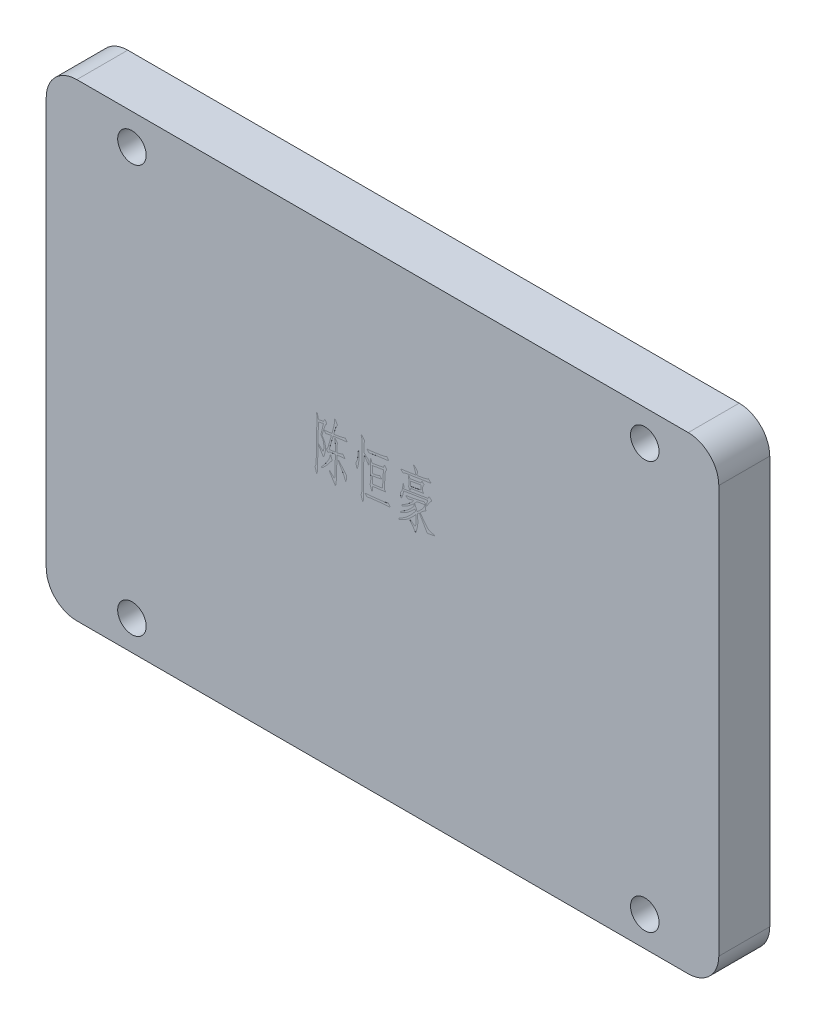
from build123d import *

# Parameters (mm, degrees)
EXTRUDE_1_DEPTH     = 25
SKETCH_4_R          = 7
CUT_EXTRUDE_5_DEPTH = 25
CUT_EXTRUDE_7_DEPTH = 0.001


with BuildPart() as part:
    # 草图2 → 凸台-拉伸1 (new body)
    with BuildSketch(Plane.XY):
        with BuildLine():
            Line((15, 0), (315, 0))
            ThreePointArc((315, 0), (325.606601718, 4.393398282), (330, 15))
            Line((330, 15), (330, 215))
            ThreePointArc((330, 215), (325.606601718, 225.606601718), (315, 230))
            Line((315, 230), (15, 230))
            ThreePointArc((15, 230), (4.393398282, 225.606601718), (0, 215))
            Line((0, 215), (0, 15))
            ThreePointArc((0, 15), (4.393398282, 4.393398282), (15, 0))
        make_face()
    extrude(amount=EXTRUDE_1_DEPTH)

    # 草图4 → 切除-拉伸5 (cut)
    with BuildSketch(Plane.XY.offset(25)):
        with Locations((293.684848485, 214.839097249)):
            Circle(SKETCH_4_R)
        with Locations((293.684848485, 14.669247649)):
            Circle(SKETCH_4_R)
        with Locations((42.049496033, 14.669247649)):
            Circle(SKETCH_4_R)
        with Locations((42.049496033, 214.839097249)):
            Circle(SKETCH_4_R)
    extrude(amount=-CUT_EXTRUDE_5_DEPTH, mode=Mode.SUBTRACT)

    # 草图5 → 切除-拉伸7 (cut)
    # profile 1 of 13: a face of its own
    with BuildSketch(Plane.XY.offset(25)):
        with BuildLine():
            Line((133.559721883, 144.852875731), (136.091151672, 145.287565695))
            Line((136.091151672, 145.287565695), (136.525841635, 146.26348728))
            add(Edge.make_bspline(
                [(136.525841635, 146.26348728), (136.546628512, 146.298616678), (136.582041878, 146.358464546), (136.672818537, 146.412428944), (136.773514904, 146.379627419), (136.816084523, 146.325348842), (136.841204942, 146.293318944)],
                knots=[0, 0, 0, 0, 1.183602122, 2.016432572, 2.829492834, 4, 4, 4, 4], degree=3))
            Line((136.841204942, 146.293318944), (137.501763221, 145.402630685))
            add(Edge.make_bspline(
                [(137.501763221, 145.402630685), (137.532043528, 145.344133642), (137.582521003, 145.246618678), (137.647387814, 145.097782708), (137.583417287, 144.935380522), (137.499688976, 144.851132498), (137.446361559, 144.797474069)],
                knots=[0, 0, 0, 0, 1.160113688, 1.93391731, 2.684090803, 4, 4, 4, 4], degree=3))
            add(Edge.make_bspline(
                [(137.446361559, 144.797474069), (137.378497811, 144.717777625), (137.256316562, 144.574292903), (137.097164581, 144.39386913), (136.990471305, 144.20558996), (136.896284388, 143.979644948), (136.773193892, 143.66402406), (136.652018312, 143.334454145), (136.539069923, 142.994640508), (136.422565798, 142.656538901), (136.291805902, 142.238932976), (136.135272575, 141.747062201), (135.948973884, 141.180709585), (135.75195783, 140.53526103), (135.523997283, 139.816140388), (135.367738364, 139.30997816), (135.285696739, 139.044224548)],
                knots=[0, 0, 0, 0, 0.711409262, 1.280814499, 1.626572014, 2.175004179, 2.941615986, 3.927194242, 4.558581013, 5.372974652, 6.355196169, 7.529599884, 8.877817874, 10.403193882, 12.111545742, 14, 14, 14, 14], degree=3))
            add(Edge.make_bspline(
                [(135.285696739, 139.044224548), (135.428615635, 138.813204832), (135.697149772, 138.379135705), (136.060881431, 137.762576121), (136.355946479, 137.221466439), (136.594349461, 136.742779097), (136.775673131, 136.282493282), (136.902952029, 135.805399138), (136.97912889, 135.292171582), (137.002933971, 134.765807641), (137.001717799, 134.262479981), (136.987560376, 133.820783689), (136.973189007, 133.455800759), (136.940781023, 133.241098738), (136.926438269, 133.146078373)],
                knots=[0, 0, 0, 0, 1.551749296, 2.915623266, 4.088451021, 5.071954527, 5.96856759, 6.909436822, 7.886053788, 8.926269579, 9.916245988, 10.760511341, 11.45144129, 12, 12, 12, 12], degree=3))
            add(Edge.make_bspline(
                [(136.926438269, 133.146078373), (136.905556139, 132.999431567), (136.862552475, 132.697434128), (136.760288099, 132.23946508), (136.642515758, 131.761167431), (136.524571671, 131.360044349), (136.423221057, 131.04991239), (136.35198563, 130.84624644), (136.284487512, 130.675243784), (136.220541743, 130.537200818), (136.162043219, 130.431507904), (136.111050072, 130.354873278), (136.061536894, 130.305466272), (135.9772198, 130.289969977), (135.870061887, 130.394462639), (135.725816106, 130.559189216), (135.540051279, 130.843464989), (135.32451714, 131.189749122), (135.11967162, 131.554682364), (134.939293915, 131.861999982), (134.807648055, 132.085915878), (134.737299835, 132.208476202), (134.710371787, 132.255390114)],
                knots=[0, 0, 0, 0, 1.643323953, 3.384182992, 5.204264395, 7.110002211, 8.022361491, 8.825165585, 9.504365004, 10.061537333, 10.513268336, 10.841327572, 11.087592878, 11.263856758, 11.731803335, 12.569752256, 13.794196423, 15.443634599, 17.117529065, 18.431658747, 19.399666856, 20, 20, 20, 20], degree=3))
            Line((134.710371787, 132.255390114), (133.704618537, 133.721403325))
            Line((133.704618537, 133.721403325), (133.419086894, 134.181663287))
            Line((133.419086894, 134.181663287), (133.589553547, 134.497026594))
            Line((133.589553547, 134.497026594), (133.904916854, 134.241326615))
            Line((133.904916854, 134.241326615), (134.91493177, 133.261143364))
            add(Edge.make_bspline(
                [(134.91493177, 133.261143364), (135.030253586, 133.153324435), (135.233182166, 132.963598475), (135.491572858, 132.700427413), (135.678703435, 132.572631105), (135.783858495, 132.434799968), (135.89899612, 132.492308177), (135.941109737, 132.648384187), (136.027008983, 132.877367622), (136.093288886, 133.201403041), (136.169208977, 133.557705738), (136.225085862, 133.90763565), (136.255577425, 134.22800946), (136.262548017, 134.430206966), (136.26587999, 134.526858258)],
                knots=[0, 0, 0, 0, 1.69886876, 2.989451939, 3.851778237, 4.286543927, 4.5180821, 5.048384876, 5.928088103, 7.178013462, 8.558314902, 9.835398827, 10.965311168, 12, 12, 12, 12], degree=3))
            add(Edge.make_bspline(
                [(136.26587999, 134.526858258), (136.263008416, 134.632069966), (136.256471595, 134.871572805), (136.209246503, 135.271048116), (136.135022384, 135.755361334), (136.038681814, 136.299335655), (135.918662744, 136.855781787), (135.747922661, 137.363911142), (135.547024045, 137.807463718), (135.302335716, 138.164459387), (135.07443434, 138.452324927), (134.909644903, 138.687569972), (134.796515649, 138.853948015), (134.755074548, 138.950068487), (134.740203451, 138.98456122)],
                knots=[0, 0, 0, 0, 0.788054353, 1.793918751, 3.009842073, 4.458377103, 5.932250149, 7.268106443, 8.467623587, 9.56546773, 10.499725846, 11.217160866, 11.719078974, 12, 12, 12, 12], degree=3))
            Line((134.740203451, 138.98456122), (135.000165096, 139.934912808))
            Line((135.000165096, 139.934912808), (136.005918345, 144.307382443))
            Line((136.005918345, 144.307382443), (133.534151885, 143.847122482))
            Line((133.534151885, 143.847122482), (133.188956914, 127.077465546))
            Line((133.188956914, 127.077465546), (133.044060259, 123.310152526))
            add(Edge.make_bspline(
                [(133.044060259, 123.310152526), (133.038409828, 123.187983487), (133.027698939, 122.956401332), (133.012162258, 122.630913692), (132.991636571, 122.348030994), (132.964840306, 122.108149661), (132.940964899, 121.908785452), (132.914338822, 121.751378277), (132.878533088, 121.637434567), (132.848867635, 121.561348054), (132.807918864, 121.515540179), (132.753970668, 121.516974), (132.708822595, 121.558563008), (132.660688878, 121.626676139), (132.613188797, 121.729219861), (132.557864057, 121.861266059), (132.497140262, 122.025971993), (132.459548733, 122.147927109), (132.438903643, 122.214904284)],
                knots=[0, 0, 0, 0, 2.220821511, 4.209762416, 5.9171518, 7.36997424, 8.592207571, 9.563576182, 10.265292878, 10.749948553, 11.060568937, 11.292729506, 11.643587854, 12.123414099, 12.815583185, 13.682715102, 14.727358043, 16, 16, 16, 16], degree=3))
            Line((132.438903643, 122.214904284), (132.038307009, 123.510450843))
            add(Edge.make_bspline(
                [(132.038307009, 123.510450843), (132.015871923, 123.574008719), (131.975765102, 123.687630051), (131.937489212, 123.840634991), (131.90402787, 123.946385753), (131.887799709, 124.031006438), (131.916257677, 124.125879842), (131.974468287, 124.259936844), (132.064110222, 124.456490706), (132.137318123, 124.60595269), (132.178941998, 124.690932411)],
                knots=[0, 0, 0, 0, 1.281666543, 2.291213438, 2.992690923, 3.401576254, 3.899798651, 4.833061569, 6.199371271, 8, 8, 8, 8], degree=3))
            add(Edge.make_bspline(
                [(132.178941998, 124.690932411), (132.207835175, 124.762780937), (132.269561953, 124.916276618), (132.316490098, 125.128991169), (132.359517745, 125.33027946), (132.374940951, 125.524864815), (132.400493515, 125.755824153), (132.4118722, 126.127330078), (132.441813655, 126.648292935), (132.459452624, 127.080265611), (132.468735307, 127.307595526)],
                knots=[0, 0, 0, 0, 0.701296675, 1.498235477, 1.970810098, 2.567045263, 3.265851488, 4.078572788, 5.936309944, 8, 8, 8, 8], degree=3))
            Line((132.468735307, 127.307595526), (132.784098614, 144.452279098))
            Line((132.784098614, 144.452279098), (132.698865288, 147.414137184))
            Line((132.698865288, 147.414137184), (132.958826933, 147.414137184))
            Line((132.958826933, 147.414137184), (133.559721883, 144.852875731))
        make_face()
    # profile 2 of 13: a face of its own
    with BuildSketch(Plane.XY.offset(25)):
        with BuildLine():
            Line((139.602764712, 132.74548174), (140.322986319, 130.529415258))
            add(Edge.make_bspline(
                [(140.322986319, 130.529415258), (140.241467297, 130.473399487), (140.088279057, 130.368136235), (139.868408062, 130.198363173), (139.662112499, 129.992082212), (139.480158127, 129.781512328), (139.304515183, 129.552014831), (139.116192242, 129.311873098), (138.887603178, 128.997445795), (138.611225799, 128.625185638), (138.290924136, 128.201056763), (137.909848384, 127.75404963), (137.484616973, 127.272905784), (137.092771277, 126.872766964), (136.781185217, 126.547986961), (136.563670252, 126.326530616), (136.368118843, 126.129973193), (136.193225496, 125.961130029), (136.044561233, 125.814208195), (135.914919525, 125.695375197), (135.812052554, 125.597621952), (135.747606606, 125.544425724), (135.720386703, 125.521957342)],
                knots=[0, 0, 0, 0, 0.869672832, 1.634264573, 2.437943214, 3.429546401, 4.079097685, 4.978396853, 6.112428414, 7.49623674, 9.054969709, 10.783565936, 12.658756027, 14.699217995, 15.70611834, 16.615764531, 17.428225752, 18.143599381, 18.753009286, 19.265517529, 19.689778143, 20, 20, 20, 20], degree=3))
            Line((135.720386703, 125.521957342), (135.200463413, 125.121360709))
            Line((135.200463413, 125.121360709), (135.085398422, 125.551789006))
            Line((135.085398422, 125.551789006), (135.375191731, 125.867152313))
            add(Edge.make_bspline(
                [(135.375191731, 125.867152313), (135.647737204, 126.177450354), (136.169793035, 126.771820534), (136.87513277, 127.657222353), (137.483353069, 128.484270736), (137.906433044, 129.148292076), (138.200747407, 129.640475026), (138.38697017, 129.973084488), (138.553310667, 130.27559609), (138.699304105, 130.547103378), (138.819577816, 130.791855271), (138.917128073, 131.008108885), (138.995106532, 131.195320075), (139.106741813, 131.515489065), (139.229930675, 132.018589102), (139.303605003, 132.473576351), (139.342803067, 132.715650076)],
                knots=[0, 0, 0, 0, 2.159588438, 4.136651856, 5.918377177, 7.525784254, 8.252025164, 8.917344007, 9.519155881, 10.057555815, 10.529354526, 10.944992106, 11.298172722, 11.589526602, 12.717519498, 14, 14, 14, 14], degree=3))
            Line((139.342803067, 132.715650076), (139.602764712, 132.74548174))
        make_face()
    # profile 3 of 13: a face of its own
    with BuildSketch(Plane.XY.offset(25)):
        with BuildLine():
            add(Edge.make_bspline(
                [(140.233491326, 142.26604428), (140.306360714, 142.537260191), (140.446283104, 143.058043747), (140.640058124, 143.805842896), (140.819151335, 144.486279664), (140.964559148, 145.101255348), (141.096133081, 145.648446338), (141.197056127, 146.12929821), (141.278678625, 146.542587753), (141.341447281, 146.894761498), (141.381593972, 147.198381097), (141.422024693, 147.463518922), (141.452103323, 147.696538155), (141.472067179, 147.898537577), (141.491488265, 148.067326915), (141.498039992, 148.205309783), (141.505878754, 148.31055943), (141.501129571, 148.370176422), (141.499206221, 148.394320436)],
                knots=[0, 0, 0, 0, 2.149723167, 4.127856925, 5.913399454, 7.535430469, 8.965036184, 10.221220699, 11.29605478, 12.189918079, 12.958834523, 13.640096228, 14.242997331, 14.756964917, 15.194099157, 15.542749987, 15.814820398, 16, 16, 16, 16], degree=3))
            Line((141.499206221, 148.394320436), (141.473636223, 149.02504705))
            Line((141.473636223, 149.02504705), (141.759167866, 149.054878714))
            Line((141.759167866, 149.054878714), (142.90981777, 147.068942213))
            add(Edge.make_bspline(
                [(142.90981777, 147.068942213), (142.851312619, 147.016583218), (142.721752418, 146.900633737), (142.548540671, 146.669552393), (142.383513778, 146.372121558), (142.236348128, 146.080576951), (142.115239789, 145.787113665), (142.010986137, 145.491554948), (141.887336302, 145.131196347), (141.750849593, 144.703543939), (141.604042916, 144.209450329), (141.43561361, 143.650812852), (141.258427287, 143.023395866), (141.134114064, 142.582829205), (141.068777924, 142.351277606)],
                knots=[0, 0, 0, 0, 0.551638906, 1.221609491, 2.019044435, 2.944643646, 3.518401218, 4.252180997, 5.150150678, 6.199940039, 7.411403679, 8.778012591, 10.306598298, 12, 12, 12, 12], degree=3))
            add(Edge.make_bspline(
                [(141.068777924, 142.351277606), (141.351667844, 142.385322772), (141.904046256, 142.451800271), (142.709082628, 142.5736715), (143.473340905, 142.697560675), (144.192862663, 142.844862733), (144.869522425, 142.997003125), (145.504547118, 143.157785217), (146.094203984, 143.335590292), (146.470177548, 143.467919014), (146.651560792, 143.531759174)],
                knots=[0, 0, 0, 0, 1.195709092, 2.334773504, 3.41680648, 4.444525962, 5.416433801, 6.327388855, 7.193071896, 8, 8, 8, 8], degree=3))
            Line((146.651560792, 143.531759174), (147.397352396, 142.781705904))
            add(Edge.make_bspline(
                [(147.397352396, 142.781705904), (147.440827358, 142.73857074), (147.517983912, 142.662017239), (147.609304412, 142.549494698), (147.666987984, 142.462661817), (147.697284383, 142.385039318), (147.658868474, 142.314503881), (147.564830132, 142.279431741), (147.42748849, 142.252062469), (147.316723933, 142.242032335), (147.252455742, 142.236212616)],
                knots=[0, 0, 0, 0, 1.49612394, 2.655224117, 3.511787102, 4.08376446, 4.549061874, 5.293699279, 6.42974091, 8, 8, 8, 8], degree=3))
            Line((147.252455742, 142.236212616), (145.756610866, 142.065745963))
            Line((145.756610866, 142.065745963), (143.860169358, 141.805784318))
            Line((143.860169358, 141.805784318), (140.783246281, 141.400926019))
            add(Edge.make_bspline(
                [(140.783246281, 141.400926019), (140.750690723, 141.29434834), (140.681643615, 141.068307655), (140.56978517, 140.711085903), (140.451627636, 140.315807869), (140.322942868, 139.882366183), (140.183838606, 139.411701818), (140.029391584, 138.905300062), (139.866365612, 138.361540505), (139.701936793, 137.795633692), (139.54019386, 137.236881259), (139.385741059, 136.717677017), (139.249673076, 136.250222965), (139.131855183, 135.835984179), (139.023456662, 135.477546607), (138.934448251, 135.171980553), (138.862466626, 134.918570783), (138.817345554, 134.768309367), (138.797309779, 134.701586577)],
                knots=[0, 0, 0, 0, 0.765509524, 1.623569758, 2.571326254, 3.599467788, 4.729488078, 5.942693816, 7.236278328, 8.628975541, 9.99083686, 11.232092146, 12.349997313, 13.335193823, 14.190419507, 14.922288109, 15.521447717, 16, 16, 16, 16], degree=3))
            Line((138.797309779, 134.701586577), (141.844401192, 135.132014874))
            Line((141.844401192, 135.132014874), (141.844401192, 137.603781335))
            add(Edge.make_bspline(
                [(141.844401192, 137.603781335), (141.842588352, 137.737299244), (141.839155505, 137.990132732), (141.840279188, 138.351279798), (141.818412969, 138.673441817), (141.804437226, 138.980955791), (141.766879628, 139.312597758), (141.699387039, 139.709779972), (141.610101186, 140.195711939), (141.538226568, 140.548721003), (141.499206221, 140.74036774)],
                knots=[0, 0, 0, 0, 1.012897869, 1.918053566, 2.738079347, 3.461283028, 4.252559842, 5.267575968, 6.516581577, 8, 8, 8, 8], degree=3))
            Line((141.499206221, 140.74036774), (141.644102876, 140.970497721))
            Line((141.644102876, 140.970497721), (143.054714425, 139.38941952))
            add(Edge.make_bspline(
                [(143.054714425, 139.38941952), (142.985350567, 139.260620061), (142.844539778, 138.999153152), (142.725136475, 138.625932015), (142.671314136, 138.258576549), (142.646800317, 137.876847847), (142.623077108, 137.38813539), (142.623856643, 137.027080917), (142.624286127, 136.828158066)],
                knots=[0, 0, 0, 0, 0.998682807, 2.027357165, 2.656287408, 3.53275709, 4.64067328, 6, 6, 6, 6], degree=3))
            Line((142.624286127, 136.828158066), (142.624286127, 135.217248201))
            add(Edge.make_bspline(
                [(142.624286127, 135.217248201), (142.867711667, 135.26905871), (143.352827156, 135.372310326), (144.070975969, 135.56587269), (144.777917818, 135.790226392), (145.24027493, 135.965193082), (145.471079223, 136.052534798)],
                knots=[0, 0, 0, 0, 1.005227553, 2.003287968, 3.003260252, 4, 4, 4, 4], degree=3))
            Line((145.471079223, 136.052534798), (146.361767482, 135.10218321))
            add(Edge.make_bspline(
                [(146.361767482, 135.10218321), (146.404308422, 135.050941315), (146.472358164, 134.968973266), (146.519733397, 134.81873485), (146.423581429, 134.708054398), (146.332244893, 134.704036993), (146.276534156, 134.701586577)],
                knots=[0, 0, 0, 0, 1.375506225, 2.200300357, 2.902272873, 4, 4, 4, 4], degree=3))
            Line((146.276534156, 134.701586577), (142.624286127, 134.296728277))
            Line((142.624286127, 134.296728277), (142.449557808, 125.35149069))
            add(Edge.make_bspline(
                [(142.449557808, 125.35149069), (142.444666381, 125.141224164), (142.435409419, 124.743297522), (142.410161765, 124.177774061), (142.375956673, 123.677702983), (142.326286229, 123.100212979), (142.241076469, 122.435396171), (142.144120102, 121.812318987), (142.065045186, 121.368776997), (142.000699394, 121.150082687), (141.962910266, 120.989311906), (141.895811482, 120.958952741), (141.874232856, 120.94918939)],
                knots=[0, 0, 0, 0, 1.40752631, 2.663725087, 3.788107538, 4.761572813, 6.543313154, 8.265731387, 9.002189516, 9.523334407, 9.846706789, 10, 10, 10, 10], degree=3))
            add(Edge.make_bspline(
                [(141.874232856, 120.94918939), (141.859715552, 120.955771794), (141.815759959, 120.975702043), (141.761769363, 121.027953664), (141.70546455, 121.103069423), (141.640878558, 121.190512458), (141.570887079, 121.313272039), (141.477917986, 121.463188919), (141.373350297, 121.653520747), (141.239418381, 121.88060534), (141.077061769, 122.147993818), (140.960742036, 122.34128931), (140.898311271, 122.445034265)],
                knots=[0, 0, 0, 0, 0.26503027, 0.802460427, 1.224516452, 1.836271537, 2.612769524, 3.58032967, 4.779953992, 6.235450434, 7.979502663, 10, 10, 10, 10], degree=3))
            Line((140.898311271, 122.445034265), (139.082841422, 125.266257363))
            Line((139.082841422, 125.266257363), (138.882543106, 125.611452335))
            Line((138.882543106, 125.611452335), (139.02743976, 125.896983977))
            Line((139.02743976, 125.896983977), (139.312971403, 125.666853997))
            Line((139.312971403, 125.666853997), (140.66818129, 124.401139102))
            add(Edge.make_bspline(
                [(140.66818129, 124.401139102), (140.765306803, 124.304709183), (140.932470518, 124.138742661), (141.152670604, 123.944025836), (141.284605776, 123.812632881), (141.362388919, 123.779639262), (141.384141231, 123.770412488)],
                knots=[0, 0, 0, 0, 1.71192679, 2.946414754, 3.705361426, 4, 4, 4, 4], degree=3))
            add(Edge.make_bspline(
                [(141.384141231, 123.770412488), (141.413823526, 123.78816916), (141.497233901, 123.838067278), (141.537328024, 124.042967464), (141.592168482, 124.322491168), (141.606180711, 124.55606789), (141.614271211, 124.690932411)],
                knots=[0, 0, 0, 0, 0.410965222, 1.154855544, 2.357246212, 4, 4, 4, 4], degree=3))
            Line((141.614271211, 124.690932411), (141.703766204, 125.841582315))
            Line((141.703766204, 125.841582315), (141.844401192, 134.181663287))
            Line((141.844401192, 134.181663287), (138.797309779, 133.75123499))
            Line((138.797309779, 133.75123499), (138.567179799, 133.435871682))
            add(Edge.make_bspline(
                [(138.567179799, 133.435871682), (138.537946461, 133.393244057), (138.486518195, 133.31825211), (138.413224745, 133.221926806), (138.3644672, 133.167391753), (138.325016824, 133.11976693), (138.28359136, 133.148711489), (138.242673226, 133.190961996), (138.195299333, 133.275404196), (138.158052019, 133.339534396), (138.136751501, 133.376208354)],
                knots=[0, 0, 0, 0, 1.762670603, 3.100949161, 3.988506115, 4.469851456, 4.792747727, 5.473472837, 6.555161957, 8, 8, 8, 8], degree=3))
            Line((138.136751501, 133.376208354), (137.646659875, 134.011196635))
            add(Edge.make_bspline(
                [(137.646659875, 134.011196635), (137.605952745, 134.066468615), (137.54329009, 134.151551722), (137.441517943, 134.264838105), (137.489892012, 134.361917422), (137.571382742, 134.454028103), (137.703130376, 134.595925894), (137.8135109, 134.698299494), (137.876789856, 134.756988239)],
                knots=[0, 0, 0, 0, 1.336786954, 2.057787421, 2.425711553, 3.197204437, 4.39321314, 6, 6, 6, 6], degree=3))
            add(Edge.make_bspline(
                [(137.876789856, 134.756988239), (137.903324964, 134.788988455), (137.966484684, 134.8651564), (138.048754253, 135.019290828), (138.139660925, 135.222392256), (138.225571116, 135.429865729), (138.300619554, 135.644652747), (138.379370481, 135.864683875), (138.460244466, 136.142607375), (138.565570837, 136.470778664), (138.678957433, 136.8534465), (138.806387627, 137.29008925), (138.953627292, 137.778684544), (139.099495289, 138.307070927), (139.247904798, 138.835724448), (139.390119333, 139.329233383), (139.511796582, 139.773382236), (139.624822554, 140.164437978), (139.715596785, 140.505177109), (139.800174799, 140.792157943), (139.861210251, 141.029155621), (139.900872972, 141.169432629), (139.918128019, 141.230459366)],
                knots=[0, 0, 0, 0, 0.365836805, 0.870776556, 1.532169054, 2.330008277, 2.84904493, 3.538317212, 4.390178236, 5.40044608, 6.577424874, 7.909194034, 9.411323698, 11.076859643, 12.742395588, 14.253066066, 15.60546954, 16.802998369, 17.842280141, 18.714616047, 19.440800816, 20, 20, 20, 20], degree=3))
            add(Edge.make_bspline(
                [(139.918128019, 141.230459366), (139.655002857, 141.191142873), (139.150189713, 141.115713057), (138.427231238, 140.976985202), (137.767013536, 140.833898749), (137.353442911, 140.712787686), (137.15656825, 140.655134414)],
                knots=[0, 0, 0, 0, 1.130566578, 2.169024289, 3.128388956, 4, 4, 4, 4], degree=3))
            Line((137.15656825, 140.655134414), (136.551411633, 141.345524357))
            add(Edge.make_bspline(
                [(136.551411633, 141.345524357), (136.515999041, 141.379828413), (136.453608893, 141.440265535), (136.387569566, 141.534770711), (136.336403581, 141.597703387), (136.312337841, 141.660894674), (136.352626469, 141.717931566), (136.437228049, 141.74729886), (136.563544537, 141.783145178), (136.666064533, 141.797419655), (136.726139952, 141.805784318)],
                knots=[0, 0, 0, 0, 1.405251442, 2.475781646, 3.26310514, 3.764671327, 4.237552464, 5.053589834, 6.273440943, 8, 8, 8, 8], degree=3))
            Line((136.726139952, 141.805784318), (138.077088173, 141.920849309))
            Line((138.077088173, 141.920849309), (140.233491326, 142.26604428))
        make_face()
    # profile 4 of 13: a face of its own
    with BuildSketch(Plane.XY.offset(25)):
        with BuildLine():
            Line((143.199611079, 132.11049346), (143.399909396, 132.455688431))
            Line((143.399909396, 132.455688431), (143.774936031, 132.080661795))
            Line((143.774936031, 132.080661795), (145.816274195, 129.753791989))
            Line((145.816274195, 129.753791989), (146.996755763, 128.283517112))
            add(Edge.make_bspline(
                [(146.996755763, 128.283517112), (147.055423803, 128.205711386), (147.158931573, 128.068439078), (147.289784313, 127.883990532), (147.374067079, 127.747920144), (147.414632112, 127.640936628), (147.414675375, 127.540324499), (147.411671045, 127.419499638), (147.391556549, 127.260480879), (147.376098093, 127.14277594), (147.367520732, 127.077465546)],
                knots=[0, 0, 0, 0, 1.753951683, 3.094489389, 4.068078404, 4.634043573, 5.120502244, 5.862406239, 6.813923237, 8, 8, 8, 8], degree=3))
            Line((147.367520732, 127.077465546), (147.197054079, 125.926815642))
            add(Edge.make_bspline(
                [(147.197054079, 125.926815642), (147.178931031, 125.845698753), (147.146748725, 125.701654085), (147.10029176, 125.51462273), (147.063539354, 125.381138331), (147.030898756, 125.292696043), (146.960950032, 125.228244386), (146.881119339, 125.297069145), (146.830021016, 125.410149585), (146.750183722, 125.597968944), (146.631904581, 125.871076953), (146.552263866, 126.088091619), (146.506664137, 126.212347284)],
                knots=[0, 0, 0, 0, 1.373730691, 2.439425175, 3.197914428, 3.639386185, 4.043646795, 4.486990526, 5.055311265, 6.18146082, 7.81362646, 10, 10, 10, 10], degree=3))
            Line((146.506664137, 126.212347284), (146.246702492, 126.877167229))
            add(Edge.make_bspline(
                [(146.246702492, 126.877167229), (146.22695646, 126.921268903), (146.182801185, 127.019887273), (146.105226249, 127.183565817), (146.007257196, 127.377523316), (145.892190386, 127.603390193), (145.759662071, 127.861046374), (145.605307985, 128.149602124), (145.436187675, 128.472785011), (145.05918568, 129.184805947), (144.467182316, 130.24923624), (143.866139383, 131.151059469), (143.570376048, 131.594831836)],
                knots=[0, 0, 0, 0, 0.267006992, 0.597070176, 1.000779513, 1.467691333, 1.997825739, 2.601797743, 3.275963065, 4.013380347, 7.054083012, 10, 10, 10, 10], degree=3))
            Line((143.570376048, 131.594831836), (143.199611079, 132.11049346))
        make_face()
    # profile 5 of 13: a face of its own
    with BuildSketch(Plane.XY.offset(25)):
        with BuildLine():
            Line((153.11224692, 141.515991009), (153.427610227, 141.545822673))
            add(Edge.make_bspline(
                [(153.427610227, 141.545822673), (153.437854549, 141.35548376), (153.458263224, 140.976291736), (153.483537905, 140.406610296), (153.50626457, 139.829997699), (153.517098529, 139.326875489), (153.504876592, 138.870719506), (153.482132966, 138.438874651), (153.449287329, 137.921523318), (153.415763573, 137.548306682), (153.397778563, 137.348081356)],
                knots=[0, 0, 0, 0, 1.088321937, 2.168148341, 3.25574469, 4.38325513, 5.04042582, 5.860614394, 6.852250577, 8, 8, 8, 8], degree=3))
            add(Edge.make_bspline(
                [(153.397778563, 137.348081356), (153.383525704, 137.225919478), (153.356674171, 136.99577382), (153.319566432, 136.671553316), (153.281630505, 136.390157063), (153.239754792, 136.130232915), (153.187220878, 135.844930643), (153.121147159, 135.489063523), (153.022258219, 135.040362055), (152.941287474, 134.616991886), (152.863867015, 134.266510612), (152.810369969, 134.031314163), (152.755249858, 133.836493527), (152.70498672, 133.683334291), (152.65957838, 133.567139575), (152.614714218, 133.496125014), (152.56855345, 133.444298482), (152.492337199, 133.466721676), (152.432917616, 133.558483238), (152.36653501, 133.700278438), (152.297214926, 133.894188243), (152.265013697, 134.04339178), (152.247128659, 134.126261625)],
                knots=[0, 0, 0, 0, 1.5431725, 2.907244513, 4.094500589, 5.105440208, 6.210226728, 7.73434187, 9.646476564, 11.974509927, 13.142205257, 14.149524528, 15.001530793, 15.677895492, 16.181081837, 16.54198577, 16.770241459, 16.95200901, 17.431597741, 18.085271165, 18.936531366, 20, 20, 20, 20], degree=3))
            Line((152.247128659, 134.126261625), (152.016998678, 135.187416537))
            add(Edge.make_bspline(
                [(152.016998678, 135.187416537), (152.003717204, 135.263995739), (151.980142797, 135.399922617), (151.955764857, 135.577010644), (151.93929501, 135.696572743), (151.925623514, 135.781626062), (151.961824116, 135.8649285), (152.02182989, 135.98375989), (152.125835079, 136.158604552), (152.274125679, 136.38311476), (152.431557964, 136.672268073), (152.566104251, 137.032260684), (152.679838223, 137.454858864), (152.76276273, 137.921267897), (152.84233152, 138.379926175), (152.899955633, 138.791257189), (152.948490828, 139.128957613), (152.990124756, 139.495297348), (153.021087118, 139.937509893), (153.041621522, 140.291455869), (153.052583592, 140.480406095)],
                knots=[0, 0, 0, 0, 0.764337363, 1.356686788, 1.751586404, 1.961478429, 2.182234026, 2.619307808, 3.282603991, 4.173538135, 5.266668493, 6.508641912, 7.941344033, 9.562357655, 11.162188558, 12.516699998, 13.644153964, 14.515285869, 16.139723093, 18, 18, 18, 18], degree=3))
            Line((153.052583592, 140.480406095), (153.11224692, 141.515991009))
        make_face()
    # profile 6 of 13: a face of its own
    with BuildSketch(Plane.XY.offset(25)):
        with BuildLine():
            add(Edge.make_bspline(
                [(156.274403323, 147.098773877), (156.235187809, 146.978282173), (156.162149001, 146.753866641), (156.073080697, 146.438261378), (156.004888291, 146.170475922), (155.960903044, 145.86521098), (155.927147705, 145.483794352), (155.88331143, 145.00402653), (155.853715363, 144.498070061), (155.847174761, 144.158258676), (155.843975026, 143.992019136)],
                knots=[0, 0, 0, 0, 0.964621123, 1.796604711, 2.497056401, 3.066101933, 4.142327995, 5.412405899, 6.73411995, 8, 8, 8, 8], degree=3))
            Line((155.843975026, 143.992019136), (155.843975026, 141.920849309))
            Line((155.843975026, 141.920849309), (156.58976663, 141.285861028))
            Line((156.58976663, 141.285861028), (157.885313189, 140.194874453))
            add(Edge.make_bspline(
                [(157.885313189, 140.194874453), (157.941271889, 140.144324192), (158.04047074, 140.054712967), (158.16128521, 139.932324901), (158.24346281, 139.847540384), (158.289879979, 139.778515894), (158.308008155, 139.69556352), (158.316174685, 139.575525454), (158.336913255, 139.401177264), (158.342437427, 139.265906105), (158.34557315, 139.189121203)],
                knots=[0, 0, 0, 0, 1.542769215, 2.734890758, 3.517016939, 3.960712926, 4.411961728, 5.230509695, 6.427935083, 8, 8, 8, 8], degree=3))
            Line((158.34557315, 139.189121203), (158.315741486, 138.409236268))
            add(Edge.make_bspline(
                [(158.315741486, 138.409236268), (158.311045619, 138.328330832), (158.302873756, 138.187537192), (158.280638163, 138.004031653), (158.261695658, 137.883567731), (158.224074083, 137.79003084), (158.11337265, 137.780976942), (158.061755717, 137.832347612), (158.030209843, 137.86374298)],
                knots=[0, 0, 0, 0, 1.761381595, 3.065199771, 3.978075495, 4.475123729, 5.068066424, 6, 6, 6, 6], degree=3))
            Line((158.030209843, 137.86374298), (157.885313189, 138.123704625))
            Line((157.885313189, 138.123704625), (157.569949882, 138.699029577))
            add(Edge.make_bspline(
                [(157.569949882, 138.699029577), (157.438870412, 138.919354596), (157.179224099, 139.355781284), (156.750226505, 139.977410291), (156.301732773, 140.568329228), (155.975672391, 140.934162175), (155.814143361, 141.115394376)],
                knots=[0, 0, 0, 0, 1.027703409, 2.03570705, 3.026897009, 4, 4, 4, 4], degree=3))
            Line((155.814143361, 141.115394376), (155.699078371, 126.557542256))
            Line((155.699078371, 126.557542256), (155.584013381, 122.504697593))
            add(Edge.make_bspline(
                [(155.584013381, 122.504697593), (155.581744069, 122.391033608), (155.577487906, 122.177853433), (155.563010374, 121.878217093), (155.552026946, 121.619485754), (155.535698692, 121.400516805), (155.513912269, 121.223001023), (155.494270304, 121.084639861), (155.471554527, 120.986540346), (155.430973063, 120.895623507), (155.362002711, 120.823060828), (155.250934911, 120.817507873), (155.210597344, 120.892750395), (155.174050597, 120.975297674), (155.131240326, 121.095589724), (155.107270017, 121.187693299), (155.093921755, 121.238982699)],
                knots=[0, 0, 0, 0, 2.115321338, 3.967347873, 5.581725405, 6.93396158, 8.051997763, 8.908125235, 9.536436596, 9.914903248, 10.757871397, 11.287196968, 11.646728142, 12.226454741, 13.012371991, 14, 14, 14, 14], degree=3))
            Line((155.093921755, 121.238982699), (154.693325121, 122.560099255))
            add(Edge.make_bspline(
                [(154.693325121, 122.560099255), (154.660530546, 122.659457804), (154.60168809, 122.837734268), (154.525286319, 123.074960672), (154.485833983, 123.252953432), (154.469563906, 123.387610186), (154.495410322, 123.50398666), (154.524724758, 123.637344645), (154.566936003, 123.80106233), (154.6407854, 124.051216002), (154.733383694, 124.36067987), (154.794645185, 124.672964248), (154.838852335, 124.924328613), (154.855555771, 125.14552763), (154.879097197, 125.400907039), (154.895202138, 125.695135443), (154.908136473, 126.031844477), (154.914607447, 126.41549143), (154.92606682, 126.845859567), (154.924355086, 127.148483905), (154.923455102, 127.307595526)],
                knots=[0, 0, 0, 0, 1.171632312, 2.102229439, 2.785243438, 3.2157536, 3.602647848, 4.107997657, 4.748208356, 5.493025614, 7.028546895, 8.360176185, 9.052930953, 9.883609869, 10.840992238, 11.924146742, 13.181251378, 14.612717703, 16.219059368, 18, 18, 18, 18], degree=3))
            Line((154.923455102, 127.307595526), (154.978856764, 144.652577414))
            add(Edge.make_bspline(
                [(154.978856764, 144.652577414), (154.977758505, 144.747760039), (154.97524984, 144.965178074), (154.962555297, 145.330429146), (154.933796292, 145.776184035), (154.906483114, 146.269161206), (154.88193448, 146.742586157), (154.849256318, 147.124316717), (154.830933377, 147.383265048), (154.807755566, 147.57687348), (154.768261073, 147.774919232), (154.739944131, 147.928340134), (154.723156786, 148.019293801)],
                knots=[0, 0, 0, 0, 0.844772482, 1.929646027, 3.242968816, 4.808743166, 6.311586214, 7.449655615, 8.208705979, 8.615274039, 9.179082496, 10, 10, 10, 10], degree=3))
            Line((154.723156786, 148.019293801), (154.518596803, 148.709683743))
            Line((154.518596803, 148.709683743), (154.778558448, 148.90998206))
            Line((154.778558448, 148.90998206), (156.274403323, 147.098773877))
        make_face()
    # profile 7 of 13: a face of its own
    with BuildSketch(Plane.XY.offset(25)):
        with BuildLine():
            add(Edge.make_bspline(
                [(162.63280946, 124.631269083), (162.30747111, 124.596047576), (161.686425248, 124.528812432), (160.799599611, 124.428184333), (160.002853523, 124.325302013), (159.295434672, 124.227163926), (158.67797833, 124.136865392), (158.151630387, 124.040333779), (157.713488439, 123.957091966), (157.454574765, 123.886800268), (157.339819901, 123.855645814)],
                knots=[0, 0, 0, 0, 1.466951132, 2.800296766, 4.000892316, 5.068089534, 6.002026531, 6.797728899, 7.467133371, 8, 8, 8, 8], degree=3))
            Line((157.339819901, 123.855645814), (156.564196632, 124.716502409))
            add(Edge.make_bspline(
                [(156.564196632, 124.716502409), (156.541613821, 124.737019103), (156.499372125, 124.775396076), (156.44168265, 124.856573115), (156.521233493, 124.926224095), (156.65172985, 124.950882741), (156.864919614, 125.004741855), (157.038342491, 125.024563157), (157.139521584, 125.036127382)],
                knots=[0, 0, 0, 0, 0.648501963, 1.213038659, 1.598619638, 2.477786128, 3.945055408, 6, 6, 6, 6], degree=3))
            Line((157.139521584, 125.036127382), (158.805833112, 125.176762371))
            Line((158.805833112, 125.176762371), (161.942419517, 125.521957342))
            Line((161.942419517, 125.521957342), (164.328952652, 125.781918987))
            add(Edge.make_bspline(
                [(164.328952652, 125.781918987), (164.542109318, 125.803971611), (164.950335594, 125.846205621), (165.534664796, 125.917450804), (166.063552939, 125.997464794), (166.535232982, 126.086726473), (166.949318965, 126.17914951), (167.306763251, 126.277029161), (167.60891528, 126.379101313), (167.785791604, 126.463708656), (167.86613569, 126.502140594)],
                knots=[0, 0, 0, 0, 1.418385201, 2.716415679, 3.895940817, 4.958139109, 5.893351459, 6.703173594, 7.410931148, 8, 8, 8, 8], degree=3))
            Line((167.86613569, 126.502140594), (168.671590623, 125.496387344))
            add(Edge.make_bspline(
                [(168.671590623, 125.496387344), (168.704342916, 125.452895011), (168.762503597, 125.375662442), (168.785190322, 125.248473919), (168.74608445, 125.136810536), (168.679478129, 125.126526538), (168.646020625, 125.121360709)],
                knots=[0, 0, 0, 0, 1.358896489, 2.41309353, 3.202869508, 4, 4, 4, 4], degree=3))
            Line((168.646020625, 125.121360709), (167.005279095, 125.006295718))
            Line((167.005279095, 125.006295718), (162.63280946, 124.631269083))
        make_face()
    # profile 8 of 13: a face of its own
    with BuildSketch(Plane.XY.offset(25)):
        with BuildLine():
            Line((167.580604048, 144.452279098), (164.213887661, 144.0218508))
            add(Edge.make_bspline(
                [(164.213887661, 144.0218508), (163.843155682, 143.967639636), (163.138666196, 143.864623989), (162.135082545, 143.721495495), (161.239911716, 143.586222843), (160.453786946, 143.455834452), (159.773712585, 143.348312584), (159.203087468, 143.244714847), (158.738064897, 143.157384548), (158.464793699, 143.097587142), (158.34557315, 143.071499213)],
                knots=[0, 0, 0, 0, 1.512343757, 2.873855874, 4.091888492, 5.166529204, 6.090338593, 6.870916525, 7.507412594, 8, 8, 8, 8], degree=3))
            Line((158.34557315, 143.071499213), (157.599781546, 143.90678581))
            add(Edge.make_bspline(
                [(157.599781546, 143.90678581), (157.56296367, 143.938780914), (157.501392787, 143.992286628), (157.432943116, 144.104535469), (157.519990131, 144.207968587), (157.602612805, 144.216634957), (157.655183208, 144.222149117)],
                knots=[0, 0, 0, 0, 1.215646578, 2.032937263, 2.748415245, 4, 4, 4, 4], degree=3))
            Line((157.655183208, 144.222149117), (159.526054719, 144.367045772))
            Line((159.526054719, 144.367045772), (162.142717834, 144.712240743))
            Line((162.142717834, 144.712240743), (164.158485999, 145.02760405))
            add(Edge.make_bspline(
                [(164.158485999, 145.02760405), (164.460527079, 145.075907762), (165.028094457, 145.166675585), (165.813747237, 145.357893183), (166.489728982, 145.556796546), (166.880712103, 145.74597881), (167.060680758, 145.833058983)],
                knots=[0, 0, 0, 0, 1.212950637, 2.279263512, 3.20794885, 4, 4, 4, 4], degree=3))
            Line((167.060680758, 145.833058983), (167.895967355, 144.882707395))
            add(Edge.make_bspline(
                [(167.895967355, 144.882707395), (167.926328652, 144.837592221), (167.981695341, 144.755320447), (168.025379051, 144.63384293), (167.98767462, 144.535390909), (167.887046429, 144.500657151), (167.754010707, 144.466428718), (167.643779055, 144.457434046), (167.580604048, 144.452279098)],
                knots=[0, 0, 0, 0, 1.255979216, 2.290396552, 2.786165243, 3.485017813, 4.558635237, 6, 6, 6, 6], degree=3))
        make_face()
    # profile 9 of 13: a face of its own
    with BuildSketch(Plane.XY.offset(25)):
        with BuildLine():
            Line((159.295924738, 141.170796038), (159.811586362, 139.419251184))
            Line((159.811586362, 139.419251184), (165.364537566, 140.425004433))
            Line((165.364537566, 140.425004433), (165.794965863, 141.375356021))
            add(Edge.make_bspline(
                [(165.794965863, 141.375356021), (165.812271734, 141.418078477), (165.840921117, 141.488804308), (165.925510033, 141.568748391), (166.036040664, 141.543898382), (166.085258103, 141.491699167), (166.114590836, 141.460589347)],
                knots=[0, 0, 0, 0, 1.254462842, 2.076728095, 2.853763582, 4, 4, 4, 4], degree=3))
            Line((166.114590836, 141.460589347), (166.920045769, 140.480406095))
            add(Edge.make_bspline(
                [(166.920045769, 140.480406095), (166.951066022, 140.431204904), (167.003640334, 140.34781684), (167.027956783, 140.211449782), (166.989672085, 140.095290051), (166.944745567, 140.030304199), (166.920045769, 139.994576136)],
                knots=[0, 0, 0, 0, 1.307630027, 2.216221432, 3.019310362, 4, 4, 4, 4], degree=3))
            Line((166.920045769, 139.994576136), (166.63025246, 139.6195495))
            add(Edge.make_bspline(
                [(166.63025246, 139.6195495), (166.581494787, 139.548441255), (166.491417836, 139.417072926), (166.397435376, 139.224568591), (166.362227771, 139.009629745), (166.341958574, 138.734750805), (166.310078402, 138.339915063), (166.294091997, 138.035678374), (166.285057489, 137.86374298)],
                knots=[0, 0, 0, 0, 0.852279961, 1.574537414, 2.089090558, 2.990971586, 4.299486859, 6, 6, 6, 6], degree=3))
            Line((166.285057489, 137.86374298), (165.854629191, 131.479766845))
            Line((165.854629191, 131.479766845), (166.314889153, 130.930011891))
            add(Edge.make_bspline(
                [(166.314889153, 130.930011891), (166.363611013, 130.864569073), (166.442222974, 130.758978107), (166.523856227, 130.597501069), (166.458873935, 130.454305039), (166.367335824, 130.447869289), (166.314889153, 130.444181932)],
                knots=[0, 0, 0, 0, 1.516074528, 2.446162589, 3.109730383, 4, 4, 4, 4], degree=3))
            Line((166.314889153, 130.444181932), (164.848875942, 130.329116941))
            Line((164.848875942, 130.329116941), (160.041716342, 129.694128661))
            Line((160.041716342, 129.694128661), (160.016146345, 128.34318044))
            add(Edge.make_bspline(
                [(160.016146345, 128.34318044), (160.014543063, 128.246387554), (160.011638224, 128.071017443), (159.99118684, 127.83602004), (159.960349872, 127.647635547), (159.91709044, 127.527260967), (159.850972568, 127.429078328), (159.751927176, 127.481103342), (159.704220026, 127.604513881), (159.665221465, 127.705465634), (159.641119709, 127.767855488)],
                knots=[0, 0, 0, 0, 1.74667148, 3.164633093, 4.287613138, 5.117205612, 5.625549478, 6.040345715, 6.788901234, 8, 8, 8, 8], degree=3))
            Line((159.641119709, 127.767855488), (159.006131429, 129.523662008))
            add(Edge.make_bspline(
                [(159.006131429, 129.523662008), (158.976937551, 129.609901095), (158.930951468, 129.745744567), (158.872712646, 129.905228323), (158.882343947, 130.011985012), (158.903820386, 130.104002948), (158.950527348, 130.220455049), (158.986151874, 130.306454985), (159.006131429, 130.354686939)],
                knots=[0, 0, 0, 0, 1.890251172, 2.977516273, 3.417992727, 4.079032163, 4.92264998, 6, 6, 6, 6], degree=3))
            add(Edge.make_bspline(
                [(159.006131429, 130.354686939), (159.042957876, 130.483361176), (159.11870501, 130.748027077), (159.159763113, 131.020261382), (159.180859748, 131.160141872)],
                knots=[0, 0, 0, 0, 0.972352216, 2, 2, 2, 2], degree=3))
            Line((159.180859748, 131.160141872), (159.210691412, 131.795130153))
            add(Edge.make_bspline(
                [(159.210691412, 131.795130153), (159.219407211, 131.89881341), (159.234922306, 132.083381179), (159.252916241, 132.326271415), (159.261042083, 132.501119584), (159.264705682, 132.594901776), (159.266093074, 132.63041675)],
                knots=[0, 0, 0, 0, 1.491356893, 2.654781689, 3.490570736, 4, 4, 4, 4], degree=3))
            Line((159.266093074, 132.63041675), (159.23626141, 132.975611721))
            Line((159.23626141, 132.975611721), (159.151028083, 138.958991222))
            Line((159.151028083, 138.958991222), (158.980561431, 141.115394376))
            Line((158.980561431, 141.115394376), (159.295924738, 141.170796038))
        make_face()
        with BuildLine():
            add(Edge.make_bspline(
                [(160.016146345, 135.10218321), (160.178032744, 135.13090247), (160.486167995, 135.185566828), (160.926304828, 135.258717881), (161.318578167, 135.339139819), (161.664751307, 135.403807769), (161.963007504, 135.468574355), (162.212324247, 135.529569723), (162.418917206, 135.576625973), (162.718193038, 135.677095349), (163.126157557, 135.841085061), (163.466626945, 136.018395402), (163.638562709, 136.10793646)],
                knots=[0, 0, 0, 0, 1.304391624, 2.482784495, 3.539274654, 4.480834964, 5.276621468, 5.960009308, 6.51761364, 6.955982702, 8.462782679, 10, 10, 10, 10], degree=3))
            Line((163.638562709, 136.10793646), (164.38861598, 135.276911529))
            add(Edge.make_bspline(
                [(164.38861598, 135.276911529), (164.419635378, 135.239185383), (164.478399368, 135.167715947), (164.499690686, 135.038291828), (164.448527184, 134.917145248), (164.370125698, 134.907139485), (164.328952652, 134.901884894)],
                knots=[0, 0, 0, 0, 1.167798593, 2.212309408, 3.061182743, 4, 4, 4, 4], degree=3))
            Line((164.328952652, 134.901884894), (160.016146345, 134.126261625))
            Line((160.016146345, 134.126261625), (160.016146345, 130.644480248))
            Line((160.016146345, 130.644480248), (162.458081141, 130.98967522))
            Line((162.458081141, 130.98967522), (164.98951093, 131.364701855))
            Line((164.98951093, 131.364701855), (165.449770892, 139.419251184))
            Line((165.449770892, 139.419251184), (159.956483016, 138.468899596))
            Line((159.956483016, 138.468899596), (160.016146345, 135.10218321))
        make_face(mode=Mode.SUBTRACT)
    # profile 10 of 13: a face of its own
    with BuildSketch(Plane.XY.offset(25)):
        with BuildLine():
            Line((173.035536926, 122.619762584), (174.096691838, 123.220657534))
            add(Edge.make_bspline(
                [(174.096691838, 123.220657534), (174.417243666, 123.411597529), (175.044247133, 123.785078596), (175.923551677, 124.394192826), (176.739705602, 125.007591606), (177.351573767, 125.549238623), (177.804493928, 125.970671487), (178.116367317, 126.258162282), (178.396222046, 126.529736818), (178.65588146, 126.769951436), (178.888985121, 126.988544309), (179.091202439, 127.188444577), (179.269660333, 127.363686346), (179.434777737, 127.519676637), (179.589517559, 127.687414878), (179.762105449, 127.872107992), (179.942082109, 128.098792076), (180.152724187, 128.345229278), (180.37367994, 128.630816539), (180.617390006, 128.944490991), (180.875635288, 129.293877539), (181.05330426, 129.537758966), (181.145487917, 129.664296997)],
                knots=[0, 0, 0, 0, 2.326082862, 4.549847765, 6.667169716, 8.688912765, 9.641797727, 10.525591211, 11.333878808, 12.073467364, 12.731466442, 13.326589066, 13.846547236, 14.291342563, 14.742531851, 15.269312631, 15.867066807, 16.546483642, 17.290831844, 18.118309949, 19.023683943, 20, 20, 20, 20], degree=3))
            add(Edge.make_bspline(
                [(181.145487917, 129.664296997), (181.126258743, 129.824910171), (181.090839447, 130.120752605), (180.990880657, 130.401215822), (180.9451896, 130.529415258)],
                knots=[0, 0, 0, 0, 1.085802139, 2, 2, 2, 2], degree=3))
            add(Edge.make_bspline(
                [(180.9451896, 130.529415258), (180.777805368, 130.367218987), (180.453840875, 130.053295556), (179.981616118, 129.603614811), (179.543415905, 129.186294081), (179.127115671, 128.814680305), (178.75083403, 128.467426167), (178.401362363, 128.160422859), (178.080612628, 127.891734049), (177.685743101, 127.569818194), (177.162882414, 127.188072343), (176.454303022, 126.754588837), (175.649821401, 126.299283837), (175.067225213, 126.015871192), (174.761511782, 125.867152313)],
                knots=[0, 0, 0, 0, 1.076734351, 2.083969869, 3.012468746, 3.871959254, 4.661701394, 5.377829063, 6.020621706, 6.594570795, 7.731309426, 9.007784005, 10.429854783, 12, 12, 12, 12], degree=3))
            Line((174.761511782, 125.867152313), (173.840991859, 125.406892352))
            Line((173.840991859, 125.406892352), (173.725926869, 125.896983977))
            Line((173.725926869, 125.896983977), (174.731680118, 126.472308929))
            add(Edge.make_bspline(
                [(174.731680118, 126.472308929), (174.805770841, 126.517414948), (174.965020259, 126.614365105), (175.213941333, 126.776660611), (175.493652573, 126.958846895), (175.794789687, 127.174753848), (176.127353413, 127.411236251), (176.483888581, 127.677966706), (176.874024798, 127.961327643), (177.430850831, 128.387580278), (178.150403766, 128.967850315), (178.98243313, 129.764733202), (179.814376535, 130.635133628), (180.334217334, 131.270162642), (180.599994629, 131.594831836)],
                knots=[0, 0, 0, 0, 0.398827809, 0.857234131, 1.36631277, 1.933546374, 2.560756327, 3.242719197, 3.980866317, 4.777799482, 6.46725809, 8.227767651, 10.071383181, 12, 12, 12, 12], degree=3))
            Line((180.599994629, 131.594831836), (180.284631322, 132.34062344))
            add(Edge.make_bspline(
                [(180.284631322, 132.34062344), (180.15584806, 132.229242832), (179.908061748, 132.014940214), (179.542677365, 131.714936985), (179.215189774, 131.432027402), (178.907653957, 131.184851325), (178.634333195, 130.959016982), (178.385565769, 130.763534943), (178.168117305, 130.591343306), (177.96812689, 130.440296077), (177.766185975, 130.294026355), (177.534340525, 130.152161406), (177.269687112, 129.992734127), (176.967233437, 129.824382856), (176.631789335, 129.640179003), (176.25947139, 129.449840737), (175.853944673, 129.24375121), (175.570028081, 129.105577253), (175.422070061, 129.033570383)],
                knots=[0, 0, 0, 0, 1.383138847, 2.661237697, 3.840371836, 4.898362469, 5.866226045, 6.720511954, 7.468490782, 8.119361597, 8.756584939, 9.492990143, 10.326204657, 11.26664165, 12.304617442, 13.434967136, 14.663279299, 16, 16, 16, 16], degree=3))
            Line((175.422070061, 129.033570383), (174.616615128, 128.628712083))
            Line((174.616615128, 128.628712083), (174.501550137, 129.178467037))
            Line((174.501550137, 129.178467037), (175.392238397, 129.694128661))
            add(Edge.make_bspline(
                [(175.392238397, 129.694128661), (175.453296702, 129.728267861), (175.5937187, 129.806781253), (175.832498519, 129.9386701), (176.125296869, 130.100302176), (176.477210664, 130.291454399), (176.881943352, 130.540731246), (177.337982197, 130.867753893), (177.845271689, 131.273973481), (178.395628683, 131.738042691), (178.944944794, 132.24655204), (179.477272236, 132.759003578), (179.95806399, 133.279439946), (180.254732616, 133.633586855), (180.399696313, 133.806636652)],
                knots=[0, 0, 0, 0, 0.385857561, 0.887395886, 1.504618794, 2.230668887, 3.096136975, 4.124510195, 5.323763553, 6.680201789, 8.094366589, 9.451913313, 10.754906876, 12, 12, 12, 12], degree=3))
            add(Edge.make_bspline(
                [(180.399696313, 133.806636652), (180.145029159, 133.75734188), (179.643735987, 133.660308823), (178.908476216, 133.484951425), (178.203647907, 133.285985345), (177.747008725, 133.134925319), (177.523071552, 133.060845047)],
                knots=[0, 0, 0, 0, 1.046394195, 2.059748416, 3.048495027, 4, 4, 4, 4], degree=3))
            Line((177.523071552, 133.060845047), (176.602551629, 133.721403325))
            add(Edge.make_bspline(
                [(176.602551629, 133.721403325), (176.57589927, 133.741211301), (176.530315221, 133.775089267), (176.482523343, 133.837394915), (176.481719703, 133.904779826), (176.525769236, 133.961225705), (176.600949695, 134.011356146), (176.715145403, 134.04905167), (176.860584651, 134.0939366), (176.971557328, 134.114744563), (177.032979927, 134.126261625)],
                knots=[0, 0, 0, 0, 0.95863849, 1.639578064, 2.171456083, 2.761521766, 3.612880583, 4.752604208, 6.202589209, 8, 8, 8, 8], degree=3))
            Line((177.032979927, 134.126261625), (177.608304879, 134.181663287))
            add(Edge.make_bspline(
                [(177.608304879, 134.181663287), (177.734874681, 134.194779431), (178.018746383, 134.224196417), (178.490071263, 134.300906917), (179.053828357, 134.403135158), (179.460823702, 134.483619486), (179.679474706, 134.526858258)],
                knots=[0, 0, 0, 0, 0.726787799, 1.630045132, 2.726783931, 4, 4, 4, 4], degree=3))
            Line((179.679474706, 134.526858258), (182.441034476, 135.072351546))
            add(Edge.make_bspline(
                [(182.441034476, 135.072351546), (182.621698754, 135.106663866), (182.968289187, 135.172489394), (183.458820465, 135.285341008), (183.900955479, 135.388383989), (184.287735775, 135.50104604), (184.626649554, 135.606887492), (184.916244139, 135.709596158), (185.152365731, 135.819849228), (185.286951185, 135.900976738), (185.3474909, 135.937469807)],
                knots=[0, 0, 0, 0, 1.44858559, 2.778999323, 3.965183468, 5.024354738, 5.951690065, 6.76250771, 7.443346745, 8, 8, 8, 8], degree=3))
            Line((185.3474909, 135.937469807), (186.037880843, 135.187416537))
            add(Edge.make_bspline(
                [(186.037880843, 135.187416537), (186.067318796, 135.158336552), (186.119904633, 135.106390164), (186.175258986, 135.029821298), (186.218623212, 134.976013638), (186.224239217, 134.917567247), (186.201722794, 134.858884489), (186.186750519, 134.812391081), (186.178515831, 134.786819903)],
                knots=[0, 0, 0, 0, 1.572937209, 2.80978159, 3.637707261, 4.128864234, 4.970883269, 6, 6, 6, 6], degree=3))
            Line((186.178515831, 134.786819903), (184.167009332, 134.471456596))
            Line((184.167009332, 134.471456596), (181.895541188, 134.096429961))
            Line((181.895541188, 134.096429961), (180.685227955, 132.771051738))
            add(Edge.make_bspline(
                [(180.685227955, 132.771051738), (180.814442225, 132.538103207), (181.073777515, 132.070571444), (181.41284798, 131.341939778), (181.711006619, 130.588167684), (181.870513242, 130.070315432), (181.95094285, 129.809193651)],
                knots=[0, 0, 0, 0, 0.989851338, 1.986648889, 2.984787989, 4, 4, 4, 4], degree=3))
            Line((181.95094285, 129.809193651), (182.901294437, 130.674311913))
            Line((182.901294437, 130.674311913), (183.47661939, 131.2198052))
            Line((183.47661939, 131.2198052), (184.167009332, 131.880363479))
            Line((184.167009332, 131.880363479), (184.512204303, 132.285221778))
            add(Edge.make_bspline(
                [(184.512204303, 132.285221778), (184.612132123, 132.406960128), (184.792994426, 132.62729795), (185.027484235, 132.926385626), (185.193156289, 133.159969847), (185.322497562, 133.338968944), (185.399882832, 133.534374697), (185.481990865, 133.770267861), (185.553973233, 134.082996413), (185.604840815, 134.31377092), (185.633022543, 134.441624932)],
                knots=[0, 0, 0, 0, 1.527147061, 2.764028413, 3.681396542, 4.307836106, 4.893755969, 5.708172817, 6.730278726, 8, 8, 8, 8], degree=3))
            Line((185.633022543, 134.441624932), (185.892984188, 134.471456596))
            Line((185.892984188, 134.471456596), (186.323412486, 132.195726786))
            add(Edge.make_bspline(
                [(186.323412486, 132.195726786), (186.226219423, 132.184573328), (186.040444494, 132.163254596), (185.779419058, 132.083496982), (185.546162464, 131.974896848), (185.412765637, 131.874223873), (185.3474909, 131.824961817)],
                knots=[0, 0, 0, 0, 1.105295846, 2.112663711, 3.076474442, 4, 4, 4, 4], degree=3))
            Line((185.3474909, 131.824961817), (184.482372639, 131.10474021))
            Line((184.482372639, 131.10474021), (183.506451054, 130.239621949))
            Line((183.506451054, 130.239621949), (184.222410994, 129.178467037))
            Line((184.222410994, 129.178467037), (185.317659236, 127.652790498))
            Line((185.317659236, 127.652790498), (186.323412486, 126.357243939))
            add(Edge.make_bspline(
                [(186.323412486, 126.357243939), (186.435084315, 126.217750428), (186.655449712, 125.942483664), (187.016861434, 125.56325165), (187.390015973, 125.212867451), (187.720852188, 124.94703757), (188.008767405, 124.753687265), (188.265298438, 124.637783813), (188.550750526, 124.529939023), (188.870673067, 124.442614631), (189.222176954, 124.36960542), (189.606824866, 124.31707041), (190.024416389, 124.271340087), (190.315038001, 124.261398222), (190.46575214, 124.256242447)],
                knots=[0, 0, 0, 0, 1.322824271, 2.610369131, 3.875845982, 5.111450031, 5.750541673, 6.437625099, 7.189993101, 8.009402909, 8.890455584, 9.847157075, 10.88355217, 12, 12, 12, 12], degree=3))
            Line((190.46575214, 124.256242447), (190.495583805, 123.795982486))
            Line((190.495583805, 123.795982486), (186.958400766, 123.220657534))
            Line((186.958400766, 123.220657534), (186.293580821, 124.34573744))
            Line((186.293580821, 124.34573744), (184.426970977, 127.537725507))
            Line((184.426970977, 127.537725507), (183.016359428, 129.894426978))
            Line((183.016359428, 129.894426978), (182.095839505, 129.088972045))
            add(Edge.make_bspline(
                [(182.095839505, 129.088972045), (182.110596969, 128.932758128), (182.1387579, 128.634662924), (182.170481719, 128.206631748), (182.20487273, 127.821811839), (182.2375777, 127.476949759), (182.255154436, 127.173863059), (182.278615677, 126.911335055), (182.295127309, 126.691104832), (182.313096047, 126.446913295), (182.328787295, 126.152922068), (182.333392903, 125.783223442), (182.317678888, 125.376915917), (182.303532975, 125.094350837), (182.296137821, 124.94663239)],
                knots=[0, 0, 0, 0, 1.360344227, 2.595876849, 3.720953399, 4.709996211, 5.598882242, 6.352676438, 6.994999262, 7.513588226, 8.475496854, 9.547057714, 10.717658862, 12, 12, 12, 12], degree=3))
            add(Edge.make_bspline(
                [(182.296137821, 124.94663239), (182.274235087, 124.720493807), (182.230015522, 124.263941233), (182.121391509, 123.577205493), (181.979668697, 122.882499076), (181.840618722, 122.308126083), (181.721004856, 121.868856487), (181.636874034, 121.581918563), (181.55996904, 121.339040096), (181.493397869, 121.13831697), (181.425523142, 120.98250682), (181.367392569, 120.867711329), (181.319690685, 120.791148871), (181.248064036, 120.747168871), (181.146710937, 120.79057285), (181.04542656, 120.892631302), (180.919762592, 121.053376118), (180.843589665, 121.18802068), (180.800292946, 121.264552697)],
                knots=[0, 0, 0, 0, 2.156570506, 4.353913444, 6.596807104, 8.88653015, 9.962916083, 10.918839527, 11.724987572, 12.381821594, 12.925478588, 13.335653567, 13.605382971, 13.774367958, 14.081906796, 14.531028528, 15.165036085, 16, 16, 16, 16], degree=3))
            Line((180.800292946, 121.264552697), (179.939436351, 122.560099255))
            Line((179.939436351, 122.560099255), (178.443591476, 124.546035757))
            Line((178.443591476, 124.546035757), (178.614058128, 124.921062392))
            Line((178.614058128, 124.921062392), (180.31020132, 123.510450843))
            add(Edge.make_bspline(
                [(180.31020132, 123.510450843), (180.384086672, 123.449067706), (180.51530965, 123.3400491), (180.704775355, 123.218452772), (180.865935951, 123.164215421), (181.016813402, 123.182684198), (181.121600605, 123.323976468), (181.201636195, 123.538554256), (181.286746204, 123.85078433), (181.324520972, 124.093842906), (181.345786234, 124.23067245)],
                knots=[0, 0, 0, 0, 1.211971499, 2.152503928, 2.822133332, 3.331893699, 3.94072183, 4.896162762, 6.252698431, 8, 8, 8, 8], degree=3))
            Line((181.345786234, 124.23067245), (181.460851224, 124.976464054))
            add(Edge.make_bspline(
                [(181.460851224, 124.976464054), (181.471176136, 125.115653578), (181.493923292, 125.422306627), (181.511122208, 125.72932238), (181.520514553, 125.896983977)],
                knots=[0, 0, 0, 0, 0.907798079, 2, 2, 2, 2], degree=3))
            add(Edge.make_bspline(
                [(181.520514553, 125.896983977), (181.521431734, 126.020584966), (181.523171487, 126.255037056), (181.511548254, 126.588784074), (181.505442025, 126.887239589), (181.495401022, 127.074641313), (181.490682888, 127.162698872)],
                knots=[0, 0, 0, 0, 1.171217371, 2.221619454, 3.164362816, 4, 4, 4, 4], degree=3))
            Line((181.490682888, 127.162698872), (181.405449562, 128.458245431))
            add(Edge.make_bspline(
                [(181.405449562, 128.458245431), (181.327559654, 128.361456242), (181.163691848, 128.1578274), (180.900188343, 127.840658927), (180.597937866, 127.507370319), (180.261520597, 127.150416016), (179.894537472, 126.770125896), (179.49236283, 126.368149398), (179.055649712, 125.9468442), (178.436671639, 125.349845632), (177.610475607, 124.625418711), (176.540222536, 123.850616365), (175.411172014, 123.158795054), (174.613232796, 122.780344782), (174.211756828, 122.58993092)],
                knots=[0, 0, 0, 0, 0.477444257, 1.004465716, 1.584312684, 2.20609813, 2.889444644, 3.615154789, 4.391133436, 5.221292308, 6.920122519, 8.60824439, 10.293468558, 12, 12, 12, 12], degree=3))
            Line((174.211756828, 122.58993092), (173.150601917, 122.099839294))
            Line((173.150601917, 122.099839294), (173.035536926, 122.619762584))
        make_face()
    # profile 11 of 13: a face of its own
    with BuildSketch(Plane.XY.offset(25)):
        with BuildLine():
            Line((175.392238397, 136.252833114), (187.273764073, 138.179106287))
            Line((187.273764073, 138.179106287), (187.674360706, 138.958991222))
            add(Edge.make_bspline(
                [(187.674360706, 138.958991222), (187.705403704, 139.015058186), (187.751232095, 139.097829145), (187.837486073, 139.225031274), (187.967584964, 139.163051754), (188.03500382, 139.109304908), (188.079219006, 139.074056213)],
                knots=[0, 0, 0, 0, 1.422467156, 2.099970509, 2.753907128, 4, 4, 4, 4], degree=3))
            Line((188.079219006, 139.074056213), (188.854842275, 138.324002942))
            add(Edge.make_bspline(
                [(188.854842275, 138.324002942), (188.889769846, 138.284880645), (188.951785333, 138.215417234), (189.022648413, 138.116384363), (189.074608943, 138.043571489), (189.105226301, 137.968901408), (189.103748131, 137.875785023), (189.0723953, 137.813040472), (189.055140591, 137.778509654)],
                knots=[0, 0, 0, 0, 1.489209614, 2.644159203, 3.461829658, 4.024283959, 4.912684998, 6, 6, 6, 6], degree=3))
            add(Edge.make_bspline(
                [(189.055140591, 137.778509654), (189.051175537, 137.771166842), (189.038062004, 137.746882124), (188.989861431, 137.712265148), (188.919445751, 137.6553487), (188.833800019, 137.600029409), (188.748623205, 137.529949447), (188.661344793, 137.44760082), (188.562626094, 137.330622457), (188.437197027, 137.190243695), (188.292627529, 137.021713481), (188.135913182, 136.818300728), (187.956316607, 136.588657694), (187.830488671, 136.424825046), (187.763855699, 136.338066441)],
                knots=[0, 0, 0, 0, 0.153417262, 0.507393457, 1.070470095, 1.844295214, 2.386707146, 3.112524082, 4.06299761, 5.218879406, 6.600136037, 8.173955594, 9.973894217, 12, 12, 12, 12], degree=3))
            Line((187.763855699, 136.338066441), (186.638775793, 134.471456596))
            Line((186.638775793, 134.471456596), (186.323412486, 134.727156575))
            Line((186.323412486, 134.727156575), (187.243932409, 137.288418028))
            Line((187.243932409, 137.288418028), (175.336836735, 135.362144855))
            add(Edge.make_bspline(
                [(175.336836735, 135.362144855), (175.301905387, 135.151806818), (175.238810381, 134.771882174), (175.146672209, 134.264312333), (175.065298092, 133.879615165), (174.997926463, 133.588665201), (174.921685983, 133.33922502), (174.81825313, 133.079455253), (174.703587843, 132.771694099), (174.560728644, 132.454230657), (174.43175333, 132.153279577), (174.320518989, 131.963379433), (174.242376504, 131.80829578), (174.175703696, 131.821213173), (174.156355166, 131.824961817)],
                knots=[0, 0, 0, 0, 2.017134334, 3.64346388, 4.879623952, 5.736874376, 6.468029823, 7.344139201, 8.382332619, 9.56815888, 10.662584177, 11.396205585, 11.824778124, 12, 12, 12, 12], degree=3))
            add(Edge.make_bspline(
                [(174.156355166, 131.824961817), (174.13631209, 131.845303353), (174.081759591, 131.900668188), (174.043991442, 132.049281031), (173.988604561, 132.255027462), (173.967867737, 132.420885489), (173.95605685, 132.515351759)],
                knots=[0, 0, 0, 0, 0.463699437, 1.262079861, 2.440587363, 4, 4, 4, 4], degree=3))
            Line((173.95605685, 132.515351759), (173.840991859, 133.406040018))
            Line((173.840991859, 133.406040018), (173.781328531, 133.75123499))
            add(Edge.make_bspline(
                [(173.781328531, 133.75123499), (173.773472745, 133.816512745), (173.760851065, 133.921392763), (173.754060831, 134.026797793), (173.751496867, 134.066598297)],
                knots=[0, 0, 0, 0, 1.244808254, 2, 2, 2, 2], degree=3))
            add(Edge.make_bspline(
                [(173.751496867, 134.066598297), (173.756219872, 134.084122902), (173.768933694, 134.131297256), (173.831087608, 134.199410609), (173.92191912, 134.285319147), (174.048843465, 134.388117514), (174.192027424, 134.53251405), (174.32666397, 134.739081872), (174.457693222, 134.999215452), (174.571502901, 135.303191749), (174.67824323, 135.61157229), (174.762589368, 135.894772511), (174.825624257, 136.135880215), (174.862162729, 136.349960361), (174.881111175, 136.564063616), (174.908846142, 136.800918469), (174.93261132, 137.075413075), (174.951659425, 137.269971693), (174.961810099, 137.373651354)],
                knots=[0, 0, 0, 0, 0.238008383, 0.640692964, 1.186363193, 1.906805564, 2.798344746, 3.868224857, 5.155727018, 6.651231436, 8.162631518, 9.478287305, 10.56442468, 11.461506343, 12.350858672, 13.41059751, 14.62011574, 16, 16, 16, 16], degree=3))
            Line((174.961810099, 137.373651354), (175.047043425, 138.468899596))
            Line((175.047043425, 138.468899596), (175.362406732, 138.468899596))
            add(Edge.make_bspline(
                [(175.362406732, 138.468899596), (175.375068016, 138.321146614), (175.397469556, 138.059728054), (175.428450177, 137.716208501), (175.448029353, 137.470471324), (175.450843816, 137.33815391), (175.451901725, 137.288418028)],
                knots=[0, 0, 0, 0, 1.502825904, 2.658941835, 3.495918879, 4, 4, 4, 4], degree=3))
            Line((175.451901725, 137.288418028), (175.392238397, 136.252833114))
        make_face()
    # profile 12 of 13: a face of its own
    with BuildSketch(Plane.XY.offset(25)):
        with BuildLine():
            Line((181.435281226, 145.14266904), (181.175319581, 146.033357299))
            Line((181.175319581, 146.033357299), (180.859956274, 147.098773877))
            Line((180.859956274, 147.098773877), (180.570162965, 147.90422881))
            Line((180.570162965, 147.90422881), (180.224967994, 148.709683743))
            Line((180.224967994, 148.709683743), (180.399696313, 148.995215386))
            Line((180.399696313, 148.995215386), (181.060254591, 148.334657108))
            Line((181.060254591, 148.334657108), (181.490682888, 147.874397146))
            Line((181.490682888, 147.874397146), (181.95094285, 147.358735522))
            add(Edge.make_bspline(
                [(181.95094285, 147.358735522), (181.986149917, 147.31550206), (182.050009765, 147.237083646), (182.120501666, 147.121944709), (182.170646285, 147.032361339), (182.199398, 146.951459103), (182.193852298, 146.856381789), (182.174557569, 146.729296419), (182.14647187, 146.55330536), (182.114056604, 146.42232848), (182.095839505, 146.348720606)],
                knots=[0, 0, 0, 0, 1.226073988, 2.223897272, 2.965289285, 3.489532604, 4.08373356, 5.030248518, 6.331025361, 8, 8, 8, 8], degree=3))
            Line((182.095839505, 146.348720606), (181.806046195, 145.198070702))
            Line((181.806046195, 145.198070702), (185.027865927, 145.747825656))
            add(Edge.make_bspline(
                [(185.027865927, 145.747825656), (185.270297132, 145.794948542), (185.735621469, 145.885396574), (186.389767257, 146.079275819), (186.970250031, 146.323663381), (187.310219251, 146.536122422), (187.47406239, 146.638513916)],
                knots=[0, 0, 0, 0, 1.12951343, 2.167996848, 3.117093171, 4, 4, 4, 4], degree=3))
            Line((187.47406239, 146.638513916), (188.454245641, 145.747825656))
            add(Edge.make_bspline(
                [(188.454245641, 145.747825656), (188.508713348, 145.690242639), (188.595349295, 145.5986515), (188.69531419, 145.482228026), (188.721390247, 145.379146287), (188.677016393, 145.311997851), (188.605770737, 145.281362005), (188.517080622, 145.264493518), (188.395400072, 145.240745555), (188.302399097, 145.2325485), (188.249685658, 145.227902366)],
                knots=[0, 0, 0, 0, 1.972754112, 3.137848728, 3.781825293, 4.44766999, 4.921130977, 5.682930865, 6.68667312, 8, 8, 8, 8], degree=3))
            Line((188.249685658, 145.227902366), (187.329165735, 145.14266904))
            Line((187.329165735, 145.14266904), (186.178515831, 144.942370724))
            Line((186.178515831, 144.942370724), (180.570162965, 144.047420798))
            Line((180.570162965, 144.047420798), (177.463408224, 143.587160837))
            add(Edge.make_bspline(
                [(177.463408224, 143.587160837), (177.315574526, 143.557811051), (177.03217652, 143.501547352), (176.626947089, 143.413169907), (176.26047672, 143.320359318), (175.927948659, 143.242696047), (175.63349056, 143.162284681), (175.377193914, 143.079777687), (175.155979924, 143.005491354), (175.022676965, 142.951332012), (174.961810099, 142.926602558)],
                knots=[0, 0, 0, 0, 1.396107638, 2.676345952, 3.841229452, 4.89760668, 5.839338744, 6.667490623, 7.391568878, 8, 8, 8, 8], degree=3))
            Line((174.961810099, 142.926602558), (174.326821819, 143.561590839))
            add(Edge.make_bspline(
                [(174.326821819, 143.561590839), (174.28504919, 143.600826177), (174.212466594, 143.669000071), (174.124300992, 143.764633987), (174.068517171, 143.837014661), (174.045815407, 143.916048598), (174.078862026, 143.995236463), (174.110404456, 144.049514763), (174.126523502, 144.077252462)],
                knots=[0, 0, 0, 0, 1.626419185, 2.826006704, 3.698834829, 4.197893403, 5.079074142, 6, 6, 6, 6], degree=3))
            Line((174.126523502, 144.077252462), (175.566966715, 144.251980781))
            Line((175.566966715, 144.251980781), (181.435281226, 145.14266904))
        make_face()
    # profile 13 of 13: a face of its own
    with BuildSketch(Plane.XY.offset(25)):
        with BuildLine():
            Line((184.482372639, 140.079809462), (185.057697591, 139.559886172))
            add(Edge.make_bspline(
                [(185.057697591, 139.559886172), (185.082957029, 139.5270444), (185.137758009, 139.455793357), (185.162147823, 139.342053139), (185.147359576, 139.234594684), (185.056061335, 139.182817241), (184.934187672, 139.141514839), (184.831240052, 139.133853917), (184.772165948, 139.129457875)],
                knots=[0, 0, 0, 0, 1.006069385, 2.182692568, 2.791831265, 3.489414872, 4.559358956, 6, 6, 6, 6], degree=3))
            Line((184.772165948, 139.129457875), (183.647086042, 138.98456122))
            Line((183.647086042, 138.98456122), (178.673721456, 138.153536289))
            add(Edge.make_bspline(
                [(178.673721456, 138.153536289), (178.66452581, 138.082613734), (178.642697526, 137.914260417), (178.626621351, 137.652864295), (178.614832413, 137.413263473), (178.596545503, 137.233121207), (178.551264624, 137.136122781), (178.501651722, 137.058270288), (178.415165668, 137.088230544), (178.366119736, 137.192084173), (178.274750918, 137.341529944), (178.217343802, 137.471847159), (178.183629831, 137.548379673)],
                knots=[0, 0, 0, 0, 1.261923377, 2.995506652, 4.602392087, 5.541675219, 6.091255193, 6.58739194, 6.873104964, 7.499572211, 8.531552221, 10, 10, 10, 10], degree=3))
            Line((178.183629831, 137.548379673), (177.923668186, 138.123704625))
            add(Edge.make_bspline(
                [(177.923668186, 138.123704625), (177.882717621, 138.204459464), (177.808827185, 138.350171988), (177.788038839, 138.511877384), (177.778771531, 138.583964587)],
                knots=[0, 0, 0, 0, 1.108413151, 2, 2, 2, 2], degree=3))
            Line((177.778771531, 138.583964587), (177.923668186, 139.244522865))
            add(Edge.make_bspline(
                [(177.923668186, 139.244522865), (177.923668186, 139.282877862), (177.923668186, 139.397942852), (177.923668186, 139.513007843), (177.923668186, 139.589717836)],
                knots=[0, 0, 0, 0, 0.666666667, 2, 2, 2, 2], degree=3))
            Line((177.923668186, 139.589717836), (177.923668186, 140.049977798))
            Line((177.923668186, 140.049977798), (177.923668186, 141.230459366))
            add(Edge.make_bspline(
                [(177.923668186, 141.230459366), (177.917916836, 141.261697536), (177.904088985, 141.336802818), (177.88175728, 141.470040828), (177.863844546, 141.645613082), (177.833020163, 141.846647598), (177.810203924, 142.045715972), (177.792174513, 142.21044368), (177.783913343, 142.327093044), (177.780165419, 142.38821071), (177.778771531, 142.410940935)],
                knots=[0, 0, 0, 0, 0.640680269, 1.540374228, 2.723813183, 4.198769927, 5.641652446, 6.764946036, 7.540672012, 8, 8, 8, 8], degree=3))
            Line((177.778771531, 142.410940935), (177.693538205, 142.781705904))
            Line((177.693538205, 142.781705904), (177.638136543, 143.241965865))
            Line((177.638136543, 143.241965865), (177.808603195, 143.38686252))
            Line((177.808603195, 143.38686252), (178.528824802, 142.15097929))
            Line((178.528824802, 142.15097929), (183.907047687, 143.071499213))
            Line((183.907047687, 143.071499213), (184.196840996, 143.791720819))
            add(Edge.make_bspline(
                [(184.196840996, 143.791720819), (184.21998248, 143.834476725), (184.254079557, 143.897474043), (184.321647737, 143.994050196), (184.438915124, 143.938199172), (184.499967114, 143.88427784), (184.542035967, 143.847122482)],
                knots=[0, 0, 0, 0, 1.270046428, 1.871309149, 2.533191418, 4, 4, 4, 4], degree=3))
            Line((184.542035967, 143.847122482), (185.142930917, 143.301629194))
            add(Edge.make_bspline(
                [(185.142930917, 143.301629194), (185.188973546, 143.255425877), (185.259714093, 143.184438448), (185.33616439, 143.054781801), (185.269339988, 142.918977099), (185.210931271, 142.835957325), (185.172762582, 142.781705904)],
                knots=[0, 0, 0, 0, 1.291207117, 1.983828915, 2.682480774, 4, 4, 4, 4], degree=3))
            add(Edge.make_bspline(
                [(185.172762582, 142.781705904), (185.110092726, 142.702701331), (184.984878153, 142.544849942), (184.850600129, 142.271789029), (184.752115474, 141.976473703), (184.725971942, 141.768194498), (184.71250262, 141.660887664)],
                knots=[0, 0, 0, 0, 0.980346207, 1.958734851, 2.948326599, 4, 4, 4, 4], degree=3))
            Line((184.71250262, 141.660887664), (184.482372639, 140.079809462))
        make_face()
        with BuildLine():
            add(Edge.make_bspline(
                [(178.673721456, 139.044224548), (179.114493044, 139.108496931), (179.986543233, 139.235657449), (181.275103526, 139.468072753), (182.531502949, 139.725953317), (183.354939728, 139.922800156), (183.762151032, 140.020146134)],
                knots=[0, 0, 0, 0, 1.031144356, 2.040080752, 3.030768005, 4, 4, 4, 4], degree=3))
            Line((183.762151032, 140.020146134), (183.966711015, 142.180810954))
            Line((183.966711015, 142.180810954), (178.643889792, 141.230459366))
            Line((178.643889792, 141.230459366), (178.673721456, 139.044224548))
        make_face(mode=Mode.SUBTRACT)
    extrude(amount=-CUT_EXTRUDE_7_DEPTH, mode=Mode.SUBTRACT)


solid = part.part
